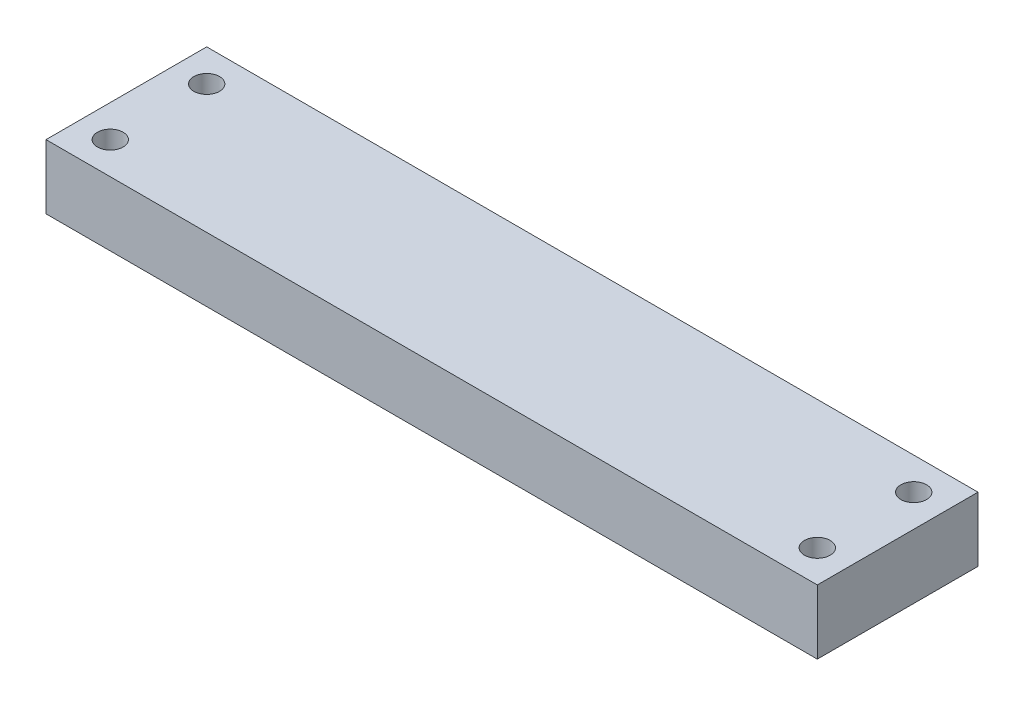
from build123d import *

# Parameters (mm, degrees)
SKETCH1_W           = 240
SKETCH1_H           = 50
SKETCH1_R           = 4
BOSS_EXTRUDE1_DEPTH = 20


with BuildPart() as part:
    # Sketch1 → Boss-Extrude1 (new body)
    with BuildSketch(Plane(origin=(0, 0, 0), x_dir=(1, 0, 0), z_dir=(0, 1, 0))):
        with Locations((120, 25)):
            Rectangle(SKETCH1_W, SKETCH1_H)
        with Locations(Location((10, 40, 0), (0, 0, 270))):
            Circle(SKETCH1_R, mode=Mode.SUBTRACT)
        with Locations(Location((10, 10, 0), (0, 0, 270))):
            Circle(SKETCH1_R, mode=Mode.SUBTRACT)
        with Locations(Location((230, 10, 0), (0, 0, 270))):
            Circle(SKETCH1_R, mode=Mode.SUBTRACT)
        with Locations(Location((230, 40, 0), (0, 0, 270))):
            Circle(SKETCH1_R, mode=Mode.SUBTRACT)
    extrude(amount=BOSS_EXTRUDE1_DEPTH)


solid = part.part
